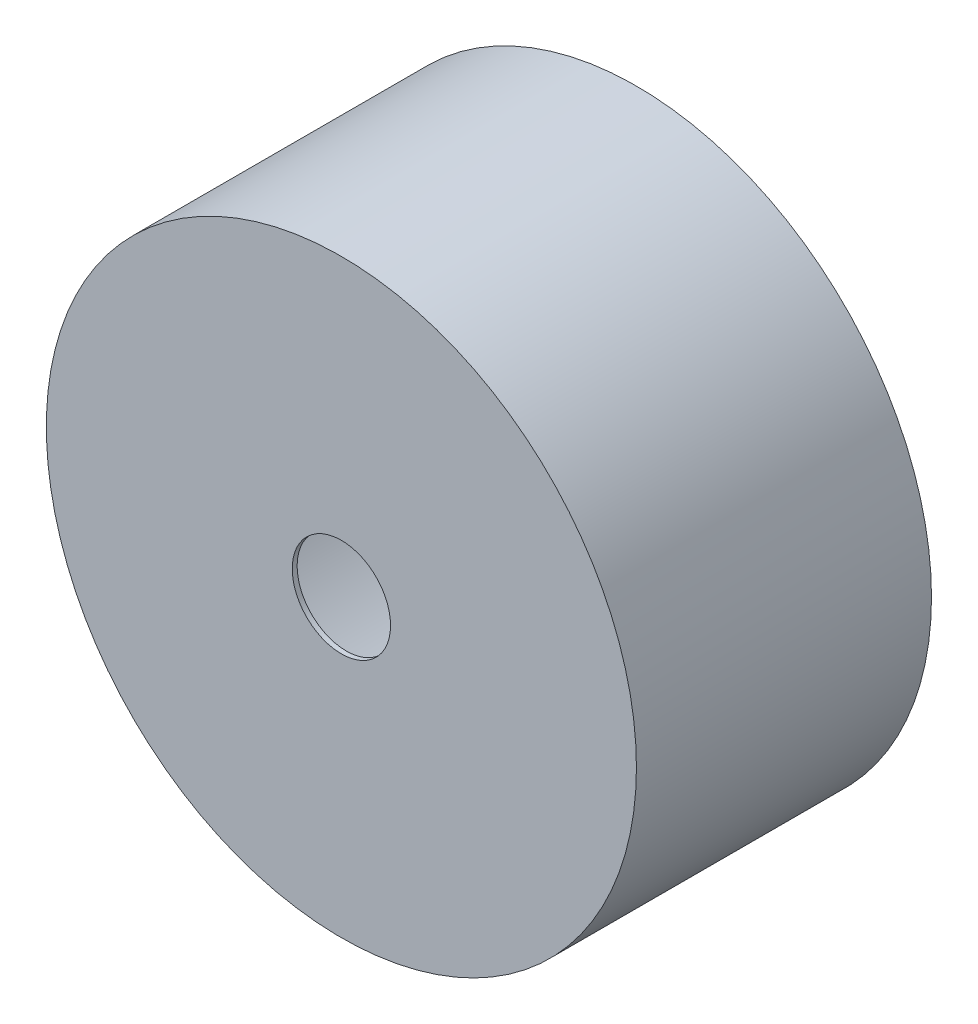
from build123d import *

# Parameters (mm, degrees)
SKETCH1_R           = 3
BOSS_EXTRUDE2_DEPTH = 3
SKETCH2_R           = 2.5
CUT_EXTRUDE2_DEPTH  = 2.95
SKETCH3_R           = 0.5
CUT_EXTRUDE3_DEPTH  = 3


with BuildPart() as part:
    # Sketch1 → Boss-Extrude2 (new body)
    with BuildSketch(Plane.XY):
        Circle(SKETCH1_R)
    extrude(amount=BOSS_EXTRUDE2_DEPTH)

    # Sketch2 → Cut-Extrude2 (cut)
    with BuildSketch(Plane(origin=(0, 0, 0), x_dir=(-1, 0, 0), z_dir=(0, 0, -1))):
        Circle(SKETCH2_R)
    extrude(amount=-CUT_EXTRUDE2_DEPTH, mode=Mode.SUBTRACT)

    # Sketch3 → Cut-Extrude3 (cut)
    with BuildSketch(Plane.XY.offset(3)):
        Circle(SKETCH3_R)
    extrude(amount=-CUT_EXTRUDE3_DEPTH, mode=Mode.SUBTRACT)


solid = part.part
